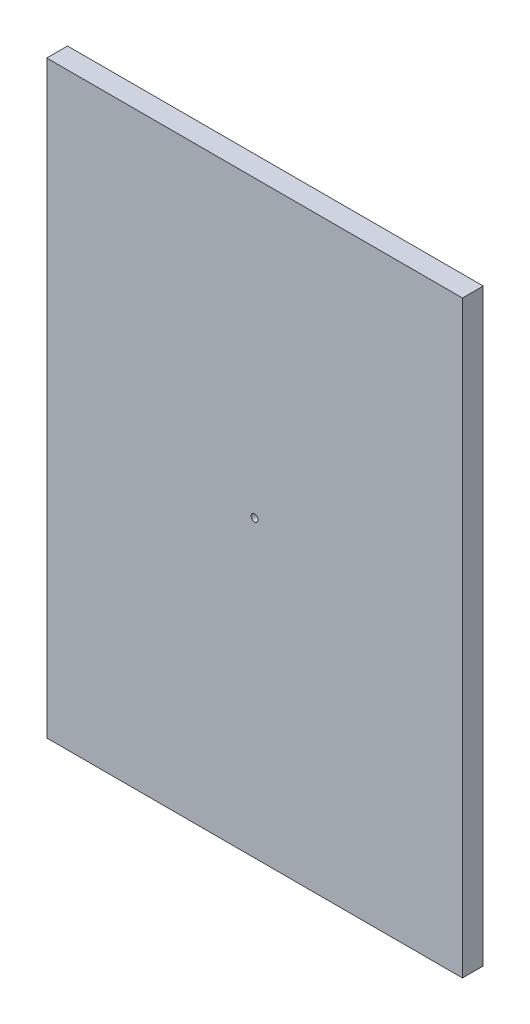
from build123d import *

# Parameters (mm, degrees)
SKETCH1_W           = 60
SKETCH1_H           = 85
SKETCH1_R           = 0.5
BOSS_EXTRUDE1_DEPTH = 3


with BuildPart() as part:
    # Sketch1 → Boss-Extrude1 (new body)
    with BuildSketch(Plane.XY):
        with Locations((30, -42.5)):
            Rectangle(SKETCH1_W, SKETCH1_H)
        with Locations((30, -42.5)):
            Circle(SKETCH1_R, mode=Mode.SUBTRACT)
    extrude(amount=BOSS_EXTRUDE1_DEPTH)


solid = part.part
